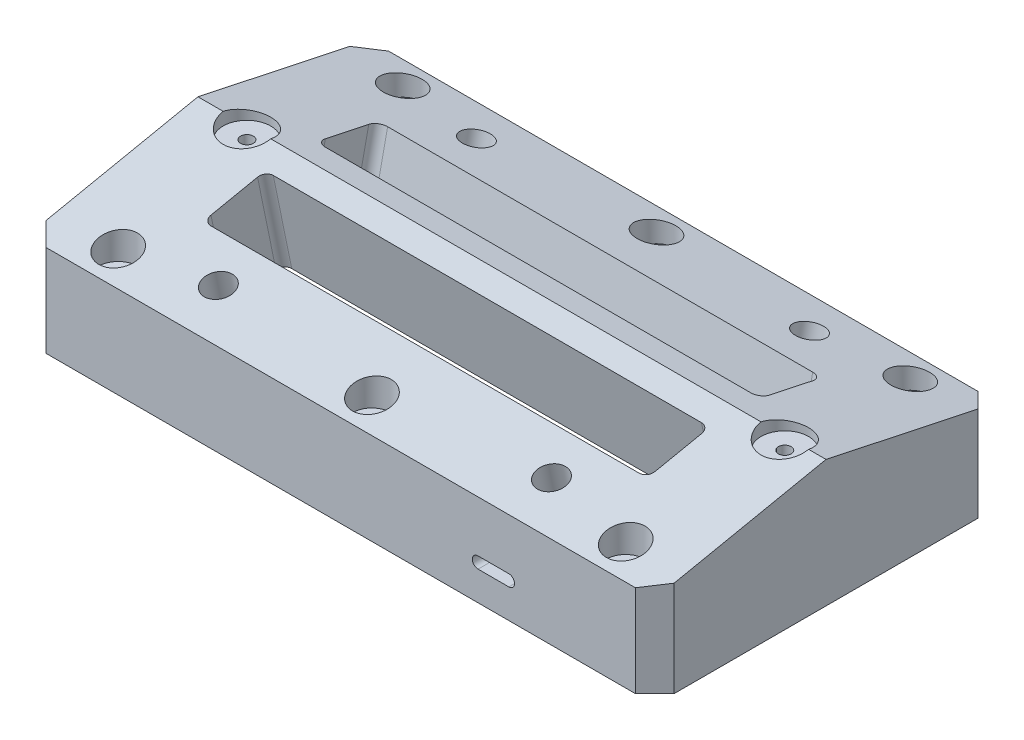
from build123d import *

# Parameters (mm, degrees)
SKETCH1_W             = 198
SKETCH1_H             = 108
BOSS_EXTRUDE1_DEPTH   = 40
SKETCH4_W             = 181
SKETCH4_H             = 45
CUT_EXTRUDE2_DEPTH    = 10
CUT_EXTRUDE3_DEPTH    = 175
BOSS_EXTRUDE11_DEPTH  = 10
CUT_EXTRUDE12_DEPTH   = 175
CUT_EXTRUDE28_DEPTH   = 14.5
CUT_EXTRUDE29_DEPTH   = 14.5
CUT_EXTRUDE40_REACH   = 231.059
CUT_EXTRUDE5_DEPTH    = 23
SKETCH12_R            = 3.15
CUT_EXTRUDE9_DEPTH    = 230.058944379
SKETCH13_R            = 4.5
CUT_EXTRUDE10_DEPTH   = 16.5
SKETCH14_R            = 4.5
CUT_EXTRUDE11_DEPTH   = 16.5
SKETCH41_R            = 2.9
CUT_EXTRUDE21_DEPTH   = 7
CUT_EXTRUDE22_DEPTH   = 10
CUT_EXTRUDE23_DEPTH   = 10
CUT_EXTRUDE32_DEPTH   = 43.3
CUT_EXTRUDE34_DEPTH   = 55.4
CUT_EXTRUDE36_DEPTH   = 55.4
SKETCH90_R            = 6.1
CUT_EXTRUDE38_DEPTH   = 17
SKETCH96_R            = 2
CUT_EXTRUDE39_DEPTH   = 230.058944379
SKETCH98_R            = 7.5
CUT_EXTRUDE41_DEPTH   = 4
CORTAR_EXTRUIR1_DEPTH = 23
CORTAR_EXTRUIR2_DEPTH = 23


with BuildPart() as part:
    # Sketch1 → Boss-Extrude1 (new body)
    with BuildSketch(Plane(origin=(0, 0, 0), x_dir=(1, 0, 0), z_dir=(0, 1, 0))):
        with Locations((99, 54)):
            Rectangle(SKETCH1_W, SKETCH1_H)
    extrude(amount=BOSS_EXTRUDE1_DEPTH)

    # Sketch4 → Cut-Extrude2 (cut)
    with BuildSketch(Plane(origin=(0, 0, 0), x_dir=(1, 0, 0), z_dir=(0, 1, 0))):
        with Locations((99, 54)):
            Rectangle(SKETCH4_W, SKETCH4_H)
    extrude(amount=CUT_EXTRUDE2_DEPTH, mode=Mode.SUBTRACT)

    # Sketch5 → Cut-Extrude3 (cut)
    with BuildSketch(Plane(origin=(198, 0, 0), x_dir=(0, 0, -1), z_dir=(1, 0, 0))):
        Polygon((54, 40), (108, 28.52194567), (108, 40), align=None)
    extrude(amount=-CUT_EXTRUDE3_DEPTH, mode=Mode.SUBTRACT)

    # Sketch53 → Boss-Extrude11 (add)
    with BuildSketch(Plane(origin=(0, 10, 0), x_dir=(-1, 0, 0), z_dir=(0, -1, 0))):
        Polygon((-8.5, 51.5), (-8.5, 31.5), (-39.5, 31.5), align=None)
        Polygon((-8.5, 56.5), (-8.5, 76.5), (-39.5, 76.5), align=None)
        Polygon((-158.5, 76.5), (-189.5, 56.5), (-189.5, 76.5), align=None)
        Polygon((-158.5, 31.5), (-189.5, 51.5), (-189.5, 31.5), align=None)
    extrude(amount=BOSS_EXTRUDE11_DEPTH)

    # Sketch18 → Cut-Extrude12 (cut)
    with BuildSketch(Plane(origin=(198, 0, 0), x_dir=(0, 0, -1), z_dir=(1, 0, 0))):
        Polygon((0, 28.915391904), (0, 40), (54, 40), align=None)
    extrude(amount=-CUT_EXTRUDE12_DEPTH, mode=Mode.SUBTRACT)

    # Izq → Cut-Extrude28 (cut)
    with BuildSketch(Plane(origin=(0, 28.012686094, -12.204810084), x_dir=(1, 0, 0), z_dir=(0, 0.9167660546215654, -0.3994245874925693))):
        Polygon((8.5, 48.862182113), (29.5, 70.132603179), (8.5, 70.132603179), align=None)
    cut_extrude28 = extrude(amount=-CUT_EXTRUDE28_DEPTH, mode=Mode.SUBTRACT)

    # Der → Cut-Extrude29 (cut)
    with BuildSketch(Plane(origin=(0, -11.144923858, -4.62106599), x_dir=(1, 0, 0), z_dir=(0, 0.9237421135716327, 0.38301502270043264))):
        Polygon((8.5, 51.290217599), (29.5, 29.097876578), (8.5, 29.097876578), align=None)
    cut_extrude29 = extrude(amount=-CUT_EXTRUDE29_DEPTH, mode=Mode.SUBTRACT)

    # Cut-Extrude40: up to this face of the body (flat: up to its plane)
    cut_extrude40_end = Plane(part.part.faces().sort_by_distance((99, 10, -54))[0])
    # Sketch97 → Cut-Extrude40 (cut, up to the picked face)
    with BuildSketch(Plane(origin=(0, 0, 0), x_dir=(1, 0, 0), z_dir=(0, 1, 0)), mode=Mode.PRIVATE) as cut_extrude40_sk1:
        Polygon((8.5, 57.5), (29.5, 76.5), (158.5, 76.5), (189.5, 56.5), (189.5, 51.5), (158.5, 31.5), (29.5, 31.5), (8.5, 51.5), align=None)
    cut_extrude40_tool1 = split(extrude(cut_extrude40_sk1.sketch, amount=CUT_EXTRUDE40_REACH, mode=Mode.PRIVATE), bisect_by=cut_extrude40_end, keep=Keep.BOTH, mode=Mode.PRIVATE)
    cut_extrude40 = cut_extrude40_tool1.solids().sort_by(Axis((96.82024, 0, -54.014019), (0, 1, 0)))[0]
    add(cut_extrude40, mode=Mode.SUBTRACT)

    # Mirror2: Cut-Extrude28, Cut-Extrude29, Cut-Extrude40 across plane
    add(cut_extrude28.mirror(Plane(origin=(99, 0, 0), x_dir=(0, 0, 1), z_dir=(1, 0, 0))), mode=Mode.SUBTRACT)
    add(cut_extrude29.mirror(Plane(origin=(99, 0, 0), x_dir=(0, 0, 1), z_dir=(1, 0, 0))), mode=Mode.SUBTRACT)
    add(cut_extrude40.mirror(Plane(origin=(99, 0, 0), x_dir=(0, 0, 1), z_dir=(1, 0, 0))), mode=Mode.SUBTRACT)

    # Sketch7 → Cut-Extrude5 (cut)
    with BuildSketch(Plane(origin=(0, 0, 0), x_dir=(0, 0, -1), z_dir=(1, 0, 0))):
        Polygon((108, 40), (108, 35), (83.505102572, 40), align=None)
        Polygon((0, 35), (0, 40), (24.494897428, 40), align=None)
    extrude(amount=CUT_EXTRUDE5_DEPTH, mode=Mode.SUBTRACT)

    # Sketch12 → Cut-Extrude9 (cut, through all)
    with BuildSketch(Plane(origin=(0, 40, 0), x_dir=(1, 0, 0), z_dir=(0, 1, 0))):
        with Locations(Location((19.7, 98.85, 0), (0, 0, 270))):
            Circle(SKETCH12_R)
        with Locations(Location((99.7, 9.15, 0), (0, 0, 270))):
            Circle(SKETCH12_R)
        with Locations(Location((179.7, 9.15, 0), (0, 0, 270))):
            Circle(SKETCH12_R)
        with Locations(Location((19.7, 9.15, 0), (0, 0, 270))):
            Circle(SKETCH12_R)
        with Locations(Location((99.7, 98.85, 0), (0, 0, 270))):
            Circle(SKETCH12_R)
        with Locations(Location((179.7, 98.85, 0), (0, 0, 270))):
            Circle(SKETCH12_R)
    extrude(amount=-CUT_EXTRUDE9_DEPTH, mode=Mode.SUBTRACT)

    # Sketch13 → Cut-Extrude10 (cut)
    with BuildSketch(Plane(origin=(0, 49.252798516, -10.469005505), x_dir=(1, 0, 0), z_dir=(0, 0.9781476007338072, -0.20791169081775226))):
        with Locations(Location((46.5, 86.70989493, 0), (0, 0, 270))):
            Circle(SKETCH13_R)
        with Locations(Location((151.5, 86.70989493, 0), (0, 0, 270))):
            Circle(SKETCH13_R)
    extrude(amount=-CUT_EXTRUDE10_DEPTH, mode=Mode.SUBTRACT)

    # Sketch14 → Cut-Extrude11 (cut)
    with BuildSketch(Plane(origin=(0, 27.155811177, 8.572008905), x_dir=(1, 0, 0), z_dir=(0, 0.9795752495993454, 0.20107792114595804))):
        with Locations(Location((46.5, 22.974220944, 0), (0, 0, 270))):
            Circle(SKETCH14_R)
        with Locations(Location((151.5, 22.974220944, 0), (0, 0, 270))):
            Circle(SKETCH14_R)
    extrude(amount=-CUT_EXTRUDE11_DEPTH, mode=Mode.SUBTRACT)

    # Sketch41 → Cut-Extrude21 (cut)
    with BuildSketch(Plane(origin=(0, 0, 0), x_dir=(1, 0, 0), z_dir=(0, 1, 0))):
        with Locations(Location((139.5, 9, 0), (0, 0, 90))):
            Circle(SKETCH41_R)
        with Locations(Location((139.5, 99, 0), (0, 0, 90))):
            Circle(SKETCH41_R)
    extrude(amount=CUT_EXTRUDE21_DEPTH, mode=Mode.SUBTRACT)

    # Sketch42 → Cut-Extrude22 (cut)
    with BuildSketch(Plane.XY):
        with BuildLine():
            Line((142.3, 12.8), (152, 12.8))
            ThreePointArc((152, 12.8), (153.8, 11), (152, 9.2))
            Line((152, 9.2), (142.3, 9.2))
            ThreePointArc((142.3, 9.2), (140.5, 11), (142.3, 12.8))
        make_face()
    extrude(amount=-CUT_EXTRUDE22_DEPTH, mode=Mode.SUBTRACT)

    # Sketch43 → Cut-Extrude23 (cut)
    with BuildSketch(Plane(origin=(0, 0, -108), x_dir=(-1, 0, 0), z_dir=(0, 0, -1))):
        with BuildLine():
            Line((-55.7, 12.8), (-46, 12.8))
            ThreePointArc((-46, 12.8), (-44.2, 11), (-46, 9.2))
            Line((-46, 9.2), (-55.7, 9.2))
            ThreePointArc((-55.7, 9.2), (-57.5, 11), (-55.7, 12.8))
        make_face()
    extrude(amount=-CUT_EXTRUDE23_DEPTH, mode=Mode.SUBTRACT)

    # Sketch6 → Cut-Extrude32 (cut)
    with BuildSketch(Plane(origin=(0, 49.252798516, -10.469005505), x_dir=(1, 0, 0), z_dir=(0, 0.9781476007338072, -0.20791169081775226))):
        with BuildLine():
            Line((32.2, 72.70989493), (166.2, 72.70989493))
            ThreePointArc((166.2, 72.70989493), (168.321320344, 71.831215273), (169.2, 69.70989493))
            Line((169.2, 69.70989493), (169.2, 55.70989493))
            ThreePointArc((169.2, 55.70989493), (168.321320344, 53.588574586), (166.2, 52.70989493))
            Line((166.2, 52.70989493), (32.2, 52.70989493))
            ThreePointArc((32.2, 52.70989493), (30.078679656, 53.588574586), (29.2, 55.70989493))
            Line((29.2, 55.70989493), (29.2, 69.70989493))
            ThreePointArc((29.2, 69.70989493), (30.078679656, 71.831215273), (32.2, 72.70989493))
        make_face()
    extrude(amount=-CUT_EXTRUDE32_DEPTH, mode=Mode.SUBTRACT)

    # Sketch83 → Cut-Extrude34 (cut)
    with BuildSketch(Plane(origin=(0, 27.746275226, 5.695492352), x_dir=(1, 0, 0), z_dir=(0, 0.9795752495993454, 0.20107792114595804))):
        with BuildLine():
            Line((31.7, 52.814246893), (166.7, 52.814246893))
            ThreePointArc((166.7, 52.814246893), (168.467766953, 52.082013846), (169.2, 50.314246893))
            Line((169.2, 50.314246893), (169.2, 35.314246893))
            ThreePointArc((169.2, 35.314246893), (168.467766953, 33.54647994), (166.7, 32.814246893))
            Line((166.7, 32.814246893), (31.7, 32.814246893))
            ThreePointArc((31.7, 32.814246893), (29.932233047, 33.54647994), (29.2, 35.314246893))
            Line((29.2, 35.314246893), (29.2, 50.314246893))
            ThreePointArc((29.2, 50.314246893), (29.932233047, 52.082013846), (31.7, 52.814246893))
        make_face()
    extrude(amount=-CUT_EXTRUDE34_DEPTH, mode=Mode.SUBTRACT)

    # Sketch85 → Cut-Extrude36 (cut)
    with BuildSketch(Plane(origin=(0, 40, 0), x_dir=(1, 0, 0), z_dir=(0, 1, 0))):
        Polygon((0, 101.9), (6.1, 108), (0, 108), align=None)
        Polygon((0, 0), (6.1, 0), (0, 6.1), align=None)
        Polygon((198, 6.1), (191.9, 0), (198, 0), align=None)
        Polygon((198, 108), (191.9, 108), (198, 101.9), align=None)
    extrude(amount=-CUT_EXTRUDE36_DEPTH, mode=Mode.SUBTRACT)

    # Sketch90 → Cut-Extrude38 (cut)
    with BuildSketch(Plane(origin=(0, 40, 0), x_dir=(1, 0, 0), z_dir=(0, 1, 0))):
        with Locations(Location((19.7, 9.15, 0), (0, 0, 270))):
            Circle(SKETCH90_R)
        with Locations(Location((99.7, 9.15, 0), (0, 0, 270))):
            Circle(SKETCH90_R)
        with Locations(Location((179.7, 9.15, 0), (0, 0, 270))):
            Circle(SKETCH90_R)
        with Locations(Location((99.7, 98.85, 0), (0, 0, 270))):
            Circle(SKETCH90_R)
        with Locations(Location((179.7, 98.85, 0), (0, 0, 270))):
            Circle(SKETCH90_R)
        with Locations(Location((19.7, 98.85, 0), (0, 0, 270))):
            Circle(SKETCH90_R)
    extrude(amount=-CUT_EXTRUDE38_DEPTH, mode=Mode.SUBTRACT)

    # Sketch96 → Cut-Extrude39 (cut, through all)
    with BuildSketch(Plane(origin=(0, 0, 0), x_dir=(1, 0, 0), z_dir=(0, 1, 0))):
        with Locations(Location((15.45, 54, 0), (0, 0, 270))):
            Circle(SKETCH96_R)
        with Locations((185, 54)):
            Circle(SKETCH96_R)
    extrude(amount=CUT_EXTRUDE39_DEPTH, mode=Mode.SUBTRACT)

    # Sketch98 → Cut-Extrude41 (cut)
    with BuildSketch(Plane(origin=(0, 40, 0), x_dir=(1, 0, 0), z_dir=(0, 1, 0))):
        with Locations(Location((185, 54, 0), (0, 0, 270))):
            Circle(SKETCH98_R)
        with Locations(Location((15.45, 54, 0), (0, 0, 270))):
            Circle(SKETCH98_R)
    extrude(amount=-CUT_EXTRUDE41_DEPTH, mode=Mode.SUBTRACT)

    # Croquis1 → Cortar-Extruir1 (cut)
    with BuildSketch(Plane(origin=(0, 0, 0), x_dir=(0, 0, -1), z_dir=(1, 0, 0))):
        Polygon((108, 40), (108, 28.52194567), (54, 40), align=None)
    extrude(amount=CORTAR_EXTRUIR1_DEPTH, mode=Mode.SUBTRACT)

    # Croquis2 → Cortar-Extruir2 (cut)
    with BuildSketch(Plane(origin=(0, 0, 0), x_dir=(0, 0, -1), z_dir=(1, 0, 0))):
        Polygon((54, 40), (0, 40), (0, 28.915391904), align=None)
    extrude(amount=CORTAR_EXTRUIR2_DEPTH, mode=Mode.SUBTRACT)


solid = part.part
